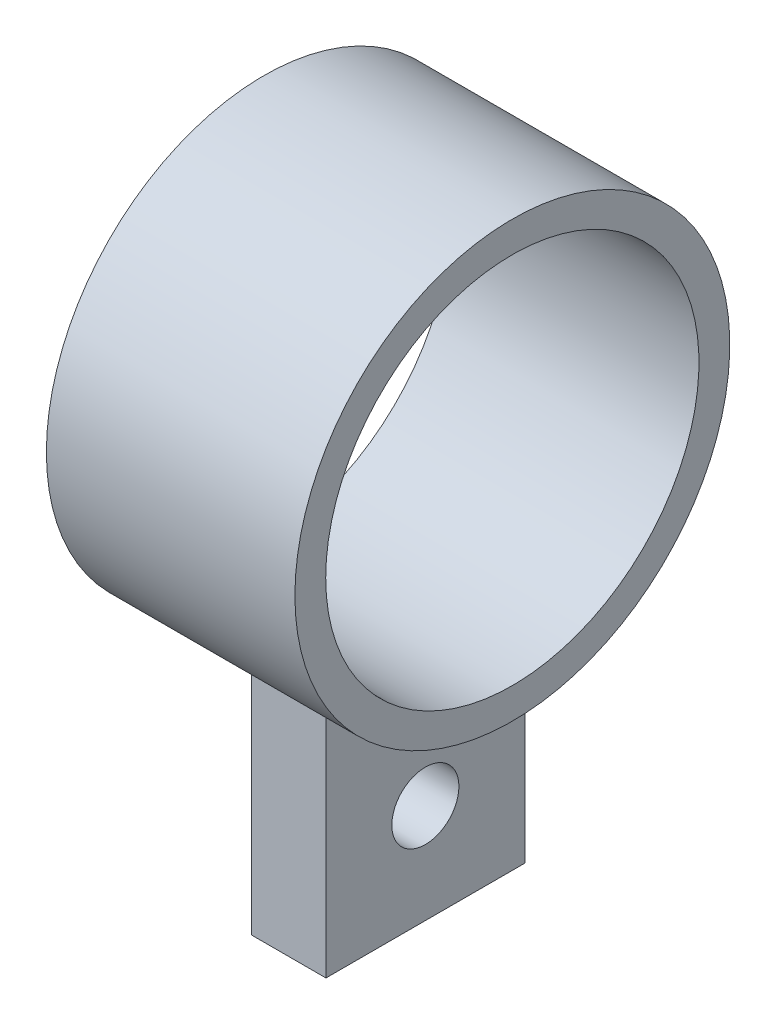
from build123d import *

# Parameters (mm, degrees)
COLLAR_SKETCH_W         = 20
COLLAR_SKETCH_H         = 2.48
TAB_SKETCH_W            = 6
TAB_SKETCH_H            = 26.896697694
TAB_DEPTH               = 8
TUBE_CLEARANCE_SKETCH_W = 8
TUBE_CLEARANCE_SKETCH_H = 15.02
PIN_HOLE_SKETCH_R       = 2.7
PIN_HOLE_DEPTH          = 6


with BuildPart() as part:
    # Collar Sketch → Collar (revolve)
    with BuildSketch(Plane.XY):
        with Locations((242.635235803, 16.26)):
            Rectangle(COLLAR_SKETCH_W, COLLAR_SKETCH_H)
    revolve(axis=Axis((-3000, 0, 0), (1, 0, 0)))

    # Tab Sketch → Tab (add, symmetric)
    with BuildSketch(Plane.XY):
        with Locations((242.635235803, -21.448348847)):
            Rectangle(TAB_SKETCH_W, TAB_SKETCH_H)
    extrude(amount=TAB_DEPTH, both=True)

    # Tube Clearance Sketch → Tube Clearance (revolve, cut)
    with BuildSketch(Plane.XY):
        with Locations((242.635235803, 7.51)):
            Rectangle(TUBE_CLEARANCE_SKETCH_W, TUBE_CLEARANCE_SKETCH_H)
    revolve(axis=Axis((-3000, 0, 0), (1, 0, 0)), mode=Mode.SUBTRACT)

    # Pin Hole Sketch → Pin Hole (cut)
    with BuildSketch(Plane(origin=(239.635235803, 0, 0), x_dir=(0, 0, -1), z_dir=(1, 0, 0))):
        with Locations((0, -26.896697694)):
            Circle(PIN_HOLE_SKETCH_R)
    extrude(amount=PIN_HOLE_DEPTH, mode=Mode.SUBTRACT)


solid = part.part
